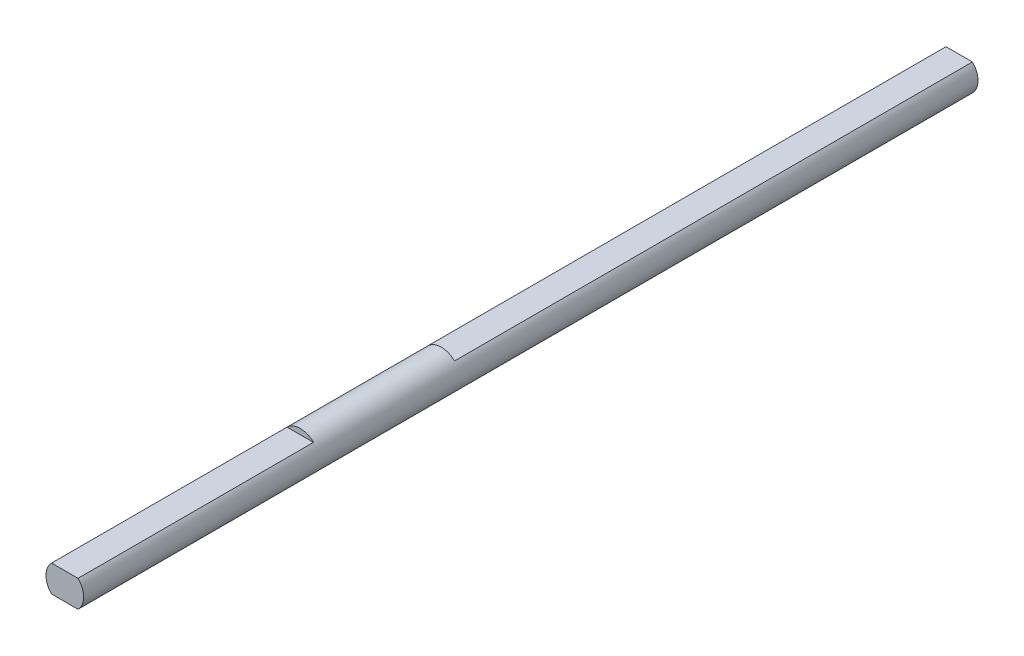
from build123d import *

# Parameters (mm, degrees)
RESSALTO_EXTRUS_O1_DEPTH      = 65
RESSALTO_EXTRUS_O1_DEPTH_BACK = 30
ESBO_O1_R                     = 2
CORTE_EXTRUS_O4_DEPTH         = 25.015
CORTE_EXTRUS_O5_DEPTH         = 55.015


with BuildPart() as part:
    # Esboço1 → Ressalto-extrusão1 (new, two sides: drawn at the far end of the back side and taken through both)
    with BuildSketch(Plane.XY.offset(-RESSALTO_EXTRUS_O1_DEPTH_BACK)):
        Circle(ESBO_O1_R)
    extrude(amount=RESSALTO_EXTRUS_O1_DEPTH + RESSALTO_EXTRUS_O1_DEPTH_BACK)

    # Esboço5 → Corte-extrusão4 (cut)
    with BuildSketch(Plane.XY.offset(65)):
        Polygon((0, 1.425), (2.691542187, 1.425), (2.691542187, 2.754428638), (-3.67257147, 2.754428638), (-3.67257147, 1.425), align=None)
        Polygon((0, -1.425), (2.691542187, -1.425), (2.691542187, -2.855047036), (-3.67257147, -2.855047036), (-3.67257147, -1.425), align=None)
    extrude(amount=-CORTE_EXTRUS_O4_DEPTH, mode=Mode.SUBTRACT)

    # Esboço6 → Corte-extrusão5 (cut)
    with BuildSketch(Plane(origin=(0, 0, -30), x_dir=(-1, 0, 0), z_dir=(0, 0, -1))):
        Polygon((0, 1.425), (2.641232941, 1.425), (2.641232941, 2.588827525), (-2.871816769, 2.588827525), (-2.871816769, 1.425), align=None)
        Polygon((0, -1.425), (2.641232941, -1.425), (2.641232941, -2.693638356), (-2.871816769, -2.693638356), (-2.871816769, -1.425), align=None)
    extrude(amount=-CORTE_EXTRUS_O5_DEPTH, mode=Mode.SUBTRACT)


solid = part.part
